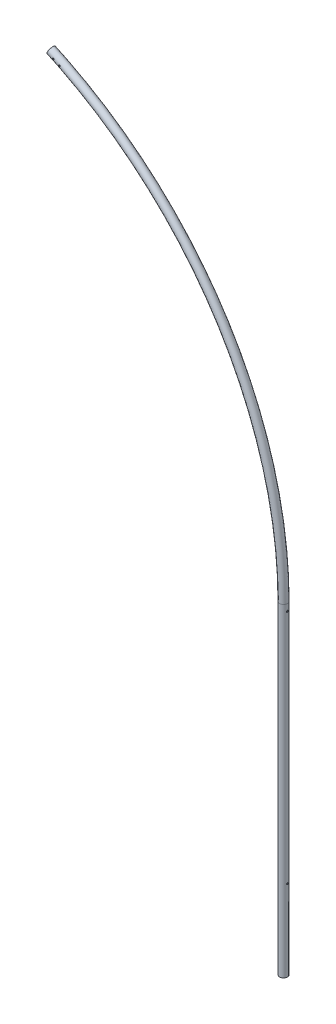
from build123d import *

# Parameters (mm, degrees)
SKETCH2_R               = 14.7701
SKETCH2_R_2             = 13.3223
SKETCH7_R               = 3.175
CUT_EXTRUDE1_DEPTH      = 31.75
CUT_EXTRUDE2_DEPTH      = 2746.095657429
CUT_EXTRUDE2_DEPTH_BACK = 2746.095657429
SKETCH8_R               = 3.175


with BuildPart() as part:
    # Sweep1: sweep along a path in Sketch1
    with BuildLine(Plane.XY) as sweep1_path:
        Line((0, 0), (0, 1219.2))
        ThreePointArc((0, 1219.2), (-240.237739707, 2036.774718578), (-884.574102374, 2594.424468676))
    # Sketch2 → Sweep1 (sweep)
    with BuildSketch(Plane(origin=(0, 0, 0), x_dir=(1, 0, 0), z_dir=(0, 1, 0))):
        with Locations((-14.7701, 0)):
            Circle(SKETCH2_R)
        with Locations((-14.7701, 0)):
            Circle(SKETCH2_R_2, mode=Mode.SUBTRACT)
    sweep(path=sweep1_path.line)

    # Sketch7 → Cut-Extrude1 (cut)
    with BuildSketch(Plane(origin=(0, 0, 0), x_dir=(0, 0, -1), z_dir=(1, 0, 0))):
        with Locations((0, 304.8)):
            Circle(SKETCH7_R)
        with Locations((0, 1193.8)):
            Circle(SKETCH7_R)
    extrude(amount=-CUT_EXTRUDE1_DEPTH, mode=Mode.SUBTRACT)

    # Sketch8 → Cut-Extrude2 (cut, two sides: drawn at the far end of the back side and taken through both)
    with BuildSketch(Plane.XY.offset(-CUT_EXTRUDE2_DEPTH_BACK)):
        with Locations(Location((-867.881837823, 2569.802206518, 0), (0, 0, 343.480242045))):
            Circle(SKETCH8_R)
        with Locations(Location((-845.023200114, 2558.710815323, 0), (0, 0, 341.89235985))):
            Circle(SKETCH8_R)
    extrude(amount=CUT_EXTRUDE2_DEPTH + CUT_EXTRUDE2_DEPTH_BACK, mode=Mode.SUBTRACT)


solid = part.part
